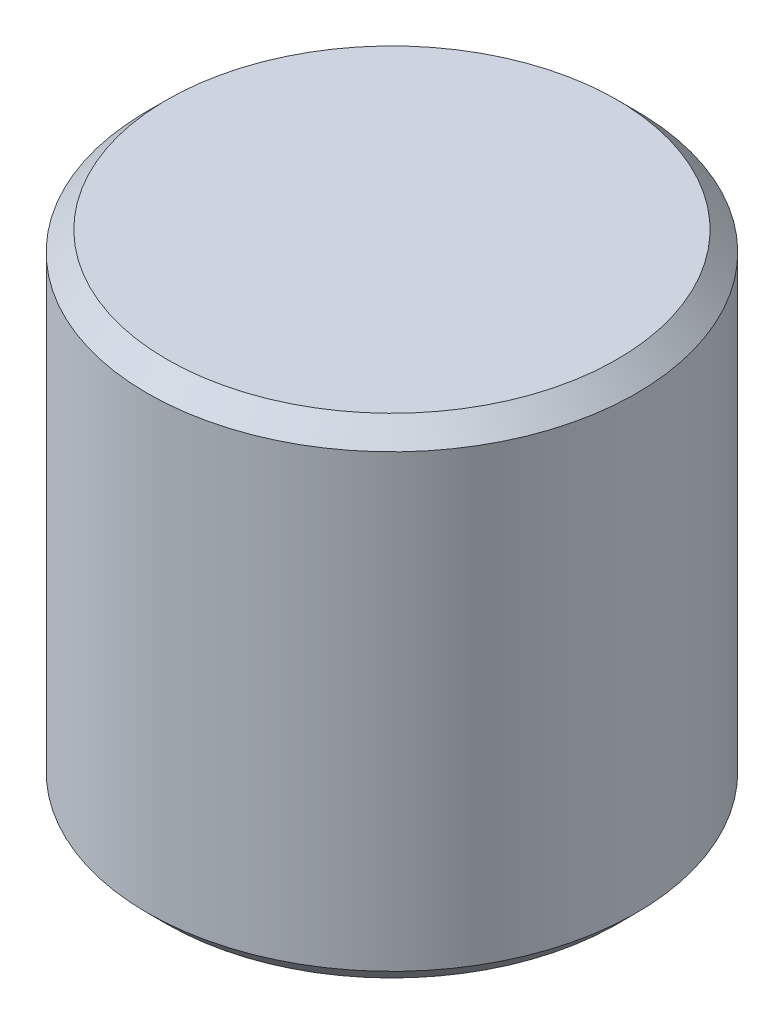
from build123d import *

# Parameters (mm, degrees)
SKETCH1_R           = 7.9375
BOSS_EXTRUDE1_DEPTH = 15.875
CHAMFER1_SIZE       = 0.635


with BuildPart() as part:
    # Sketch1 → Boss-Extrude1 (new body)
    with BuildSketch(Plane(origin=(0, 0, 0), x_dir=(1, 0, 0), z_dir=(0, 1, 0))):
        with Locations(Location((0, 0, 0), (0, 0, 270))):
            Circle(SKETCH1_R)
    extrude(amount=BOSS_EXTRUDE1_DEPTH)

    # Chamfer1
    chamfer1_edges = [part.edges().sort_by_distance(p)[0] for p in [
        (0, 0, -7.9375),
        (0, 15.875, -7.9375),
    ]]
    chamfer(chamfer1_edges, length=CHAMFER1_SIZE)


solid = part.part
